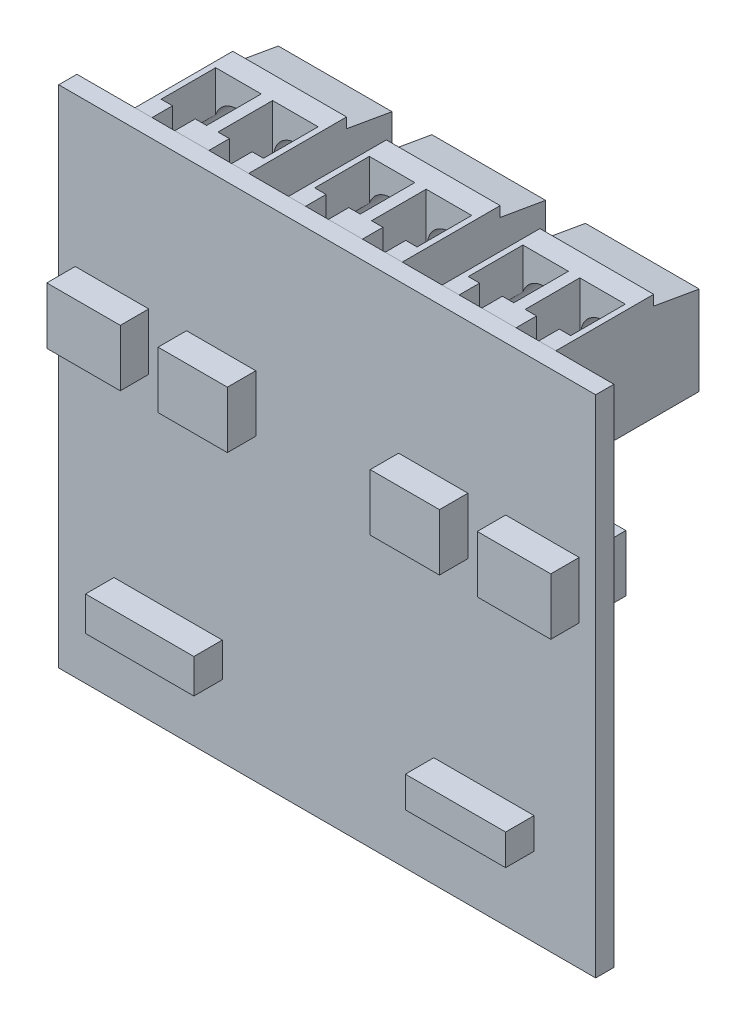
from build123d import *

# Parameters (mm, degrees)
SKETCH1_W             = 47.2
SKETCH1_H             = 44.4
BOSS_EXTRUDE1_DEPTH   = 1.6
SKETCH3_W             = 10
SKETCH3_H             = 12.6
BOSS_EXTRUDE2_DEPTH   = 9.4
BOSS_EXTRUDE2_2_DEPTH = 9.4
BOSS_EXTRUDE2_3_DEPTH = 9.4
SKETCH4_R             = 0.9
SKETCH4_R_2           = 2
CUT_EXTRUDE1_DEPTH    = 12.6
CUT_EXTRUDE2_START    = -37
CUT_EXTRUDE2_DEPTH    = 37
CUT_EXTRUDE3_DEPTH    = 8.4
SKETCH7_R             = 3.25
BOSS_EXTRUDE3_DEPTH   = 11.4
BOSS_EXTRUDE3_2_DEPTH = 11.4
SKETCH8_W             = 6.460426468
SKETCH8_H             = 4.983757561
BOSS_EXTRUDE4_DEPTH   = 2.5
SKETCH8_W_2           = 6.091259241
BOSS_EXTRUDE4_2_DEPTH = 2.5
BOSS_EXTRUDE4_3_DEPTH = 2.5
BOSS_EXTRUDE4_4_DEPTH = 2.5
BOSS_EXTRUDE5_DEPTH   = 15
CUT_EXTRUDE4_REACH    = 37.105
SKETCH10_W            = 1
SKETCH10_H            = 5.366190282
SKETCH10_W_2          = 2
CUT_EXTRUDE6_START    = -5.433939
SKETCH11_W            = 5
SKETCH11_H            = 5.781612216
CUT_EXTRUDE6_DEPTH    = 5.433939
SKETCH12_W            = 9.520452494
SKETCH12_H            = 3.010143068
BOSS_EXTRUDE6_DEPTH   = 2.5
SKETCH13_W            = 8.81009107
SKETCH13_H            = 2.717130891
BOSS_EXTRUDE7_DEPTH   = 2.5


with BuildPart() as part:
    # Sketch1 → Boss-Extrude1 (new body)
    with BuildSketch(Plane.XY):
        Rectangle(SKETCH1_W, SKETCH1_H)
    extrude(amount=-BOSS_EXTRUDE1_DEPTH)


with BuildPart() as body_2:
    # Sketch3 → Boss-Extrude2 (new body)
    with BuildSketch(Plane(origin=(0, 22.2, 0), x_dir=(1, 0, 0), z_dir=(0, 1, 0))):
        with Locations((13.5, 7.9)):
            Rectangle(SKETCH3_W, SKETCH3_H)
    extrude(amount=-BOSS_EXTRUDE2_DEPTH)


with BuildPart() as body_3:
    # Sketch3 → Boss-Extrude2 2 (new body)
    with BuildSketch(Plane(origin=(0, 22.2, 0), x_dir=(1, 0, 0), z_dir=(0, 1, 0))):
        with Locations((-13.5, 7.9)):
            Rectangle(SKETCH3_W, SKETCH3_H)
    extrude(amount=-BOSS_EXTRUDE2_2_DEPTH)


with BuildPart() as body_4:
    # Sketch3 → Boss-Extrude2 3 (new body)
    with BuildSketch(Plane(origin=(0, 22.2, 0), x_dir=(1, 0, 0), z_dir=(0, 1, 0))):
        with Locations((0, 7.9)):
            Rectangle(SKETCH3_W, SKETCH3_H)
    extrude(amount=-BOSS_EXTRUDE2_3_DEPTH)


with BuildPart() as cut_extrude1_tool:
    # Sketch4 → Cut-Extrude1 (new body)
    with BuildSketch(Plane(origin=(0, 0, -14.2), x_dir=(-1, 0, 0), z_dir=(0, 0, -1))):
        with Locations((-16.1, 14.4)):
            Circle(SKETCH4_R)
        with Locations((-10.9, 14.4)):
            Circle(SKETCH4_R)
        with Locations((-16.1, 18)):
            Circle(SKETCH4_R_2)
        with Locations((-10.9, 18)):
            Circle(SKETCH4_R_2)
        with Locations(Location((2.6, 18, 0), (0, 0, 180))):
            Circle(SKETCH4_R_2)
        with Locations(Location((2.6, 14.4, 0), (0, 0, 180))):
            Circle(SKETCH4_R)
        with Locations(Location((-2.6, 14.4, 0), (0, 0, 180))):
            Circle(SKETCH4_R)
        with Locations(Location((-2.6, 18, 0), (0, 0, 180))):
            Circle(SKETCH4_R_2)
        with Locations((16.1, 14.4)):
            Circle(SKETCH4_R)
        with Locations((16.1, 18)):
            Circle(SKETCH4_R_2)
        with Locations((10.9, 14.4)):
            Circle(SKETCH4_R)
        with Locations((10.9, 18)):
            Circle(SKETCH4_R_2)
    extrude(amount=-CUT_EXTRUDE1_DEPTH)


with BuildPart() as body_2_1:
    add(body_2.part)

    # Cut-Extrude1: cut by cut_extrude1_tool
    add(cut_extrude1_tool.part, mode=Mode.SUBTRACT)


with BuildPart() as body_3_1:
    add(body_3.part)

    # Cut-Extrude1: cut by cut_extrude1_tool
    add(cut_extrude1_tool.part, mode=Mode.SUBTRACT)


with BuildPart() as body_4_1:
    add(body_4.part)

    # Cut-Extrude1: cut by cut_extrude1_tool
    add(cut_extrude1_tool.part, mode=Mode.SUBTRACT)


with BuildPart() as cut_extrude2_tool:
    # Sketch5 → Cut-Extrude2 (new body)
    with BuildSketch(Plane.ZY.offset(18.5).offset(CUT_EXTRUDE2_START)):
        Polygon((-14.2, 20.6), (-14.2, 22.2), (-10.2, 22.2), (-10.2, 21.3), align=None)
    extrude(amount=CUT_EXTRUDE2_DEPTH)


with BuildPart() as body_2_2:
    add(body_2_1.part)

    # Cut-Extrude2: cut by cut_extrude2_tool
    add(cut_extrude2_tool.part, mode=Mode.SUBTRACT)


with BuildPart() as body_3_2:
    add(body_3_1.part)

    # Cut-Extrude2: cut by cut_extrude2_tool
    add(cut_extrude2_tool.part, mode=Mode.SUBTRACT)


with BuildPart() as body_4_2:
    add(body_4_1.part)

    # Cut-Extrude2: cut by cut_extrude2_tool
    add(cut_extrude2_tool.part, mode=Mode.SUBTRACT)


with BuildPart() as cut_extrude3_tool:
    # Sketch6 → Cut-Extrude3 (new body)
    with BuildSketch(Plane(origin=(0, 22.2, 0), x_dir=(1, 0, 0), z_dir=(0, 1, 0))):
        Polygon((-12, 1.6), (-10, 1.6), (-10, 3.4), (-9, 3.4), (-9, 8.2), (-13, 8.2), (-13, 3.4), (-12, 3.4), align=None)
        Polygon((-17, 1.6), (-15, 1.6), (-15, 3.4), (-14, 3.4), (-14, 8.2), (-18, 8.2), (-18, 3.4), (-17, 3.4), align=None)
        Polygon((-0.5, 3.4), (-1.5, 3.4), (-1.5, 1.6), (-3.5, 1.6), (-3.5, 3.4), (-4.5, 3.4), (-4.5, 8.2), (-0.5, 8.2), align=None)
        Polygon((0.5, 8.2), (4.5, 8.2), (4.5, 3.4), (3.5, 3.4), (3.5, 1.6), (1.5, 1.6), (1.5, 3.4), (0.5, 3.4), align=None)
        Polygon((15, 1.6), (17, 1.6), (17, 3.4), (18, 3.4), (18, 8.2), (14, 8.2), (14, 3.4), (15, 3.4), align=None)
        Polygon((10, 1.6), (12, 1.6), (12, 3.4), (13, 3.4), (13, 8.2), (9, 8.2), (9, 3.4), (10, 3.4), align=None)
    extrude(amount=-CUT_EXTRUDE3_DEPTH)


with BuildPart() as body_2_3:
    add(body_2_2.part)

    # Cut-Extrude3: cut by cut_extrude3_tool
    add(cut_extrude3_tool.part, mode=Mode.SUBTRACT)


with BuildPart() as body_3_3:
    add(body_3_2.part)

    # Cut-Extrude3: cut by cut_extrude3_tool
    add(cut_extrude3_tool.part, mode=Mode.SUBTRACT)


with BuildPart() as body_4_3:
    add(body_4_2.part)

    # Cut-Extrude3: cut by cut_extrude3_tool
    add(cut_extrude3_tool.part, mode=Mode.SUBTRACT)


with BuildPart() as body_5:
    # Sketch7 → Boss-Extrude3 (new body)
    with BuildSketch(Plane(origin=(0, 0, -1.6), x_dir=(-1, 0, 0), z_dir=(0, 0, -1))):
        with Locations((0, 9.3)):
            Circle(SKETCH7_R)
    extrude(amount=BOSS_EXTRUDE3_DEPTH)


with BuildPart() as body_6:
    # Sketch7 → Boss-Extrude3 2 (new body)
    with BuildSketch(Plane(origin=(0, 0, -1.6), x_dir=(-1, 0, 0), z_dir=(0, 0, -1))):
        with Locations((0, 1.3)):
            Circle(SKETCH7_R)
    extrude(amount=BOSS_EXTRUDE3_2_DEPTH)


with BuildPart() as body_7:
    # Sketch8 → Boss-Extrude4 (new body)
    with BuildSketch(Plane(origin=(0, 0, -1.6), x_dir=(-1, 0, 0), z_dir=(0, 0, -1))):
        with Locations((-18.919820371, 6.598889179)):
            Rectangle(SKETCH8_W, SKETCH8_H)
    boss_extrude4 = extrude(amount=BOSS_EXTRUDE4_DEPTH)


with BuildPart() as body_8:
    # Sketch8 → Boss-Extrude4 2 (new body)
    with BuildSketch(Plane(origin=(0, 0, -1.6), x_dir=(-1, 0, 0), z_dir=(0, 0, -1))):
        with Locations((-9.321472476, 6.598889179)):
            Rectangle(SKETCH8_W_2, SKETCH8_H)
    boss_extrude4_2 = extrude(amount=BOSS_EXTRUDE4_2_DEPTH)


with BuildPart() as body_9:
    # Sketch8 → Boss-Extrude4 3 (new body)
    with BuildSketch(Plane(origin=(0, 0, -1.6), x_dir=(-1, 0, 0), z_dir=(0, 0, -1))):
        with Locations((9.321472476, 6.598889179)):
            Rectangle(SKETCH8_W_2, SKETCH8_H)
    boss_extrude4_3 = extrude(amount=BOSS_EXTRUDE4_3_DEPTH)


with BuildPart() as body_10:
    # Sketch8 → Boss-Extrude4 4 (new body)
    with BuildSketch(Plane(origin=(0, 0, -1.6), x_dir=(-1, 0, 0), z_dir=(0, 0, -1))):
        with Locations((18.919820371, 6.598889179)):
            Rectangle(SKETCH8_W, SKETCH8_H)
    boss_extrude4_4 = extrude(amount=BOSS_EXTRUDE4_4_DEPTH)


with BuildPart() as body_11:
    # Sketch9 → Boss-Extrude5 (new, symmetric)
    with BuildSketch(Plane.ZY):
        with BuildLine():
            Line((-1.705871918, -18.684144511), (-3.536715786, -18.684144511))
            Line((-3.536715786, -18.684144511), (-3.536715786, -19.099566445))
            Line((-3.536715786, -19.099566445), (-4.433938739, -19.099566445))
            ThreePointArc((-4.433938739, -19.099566445), (-5.14104552, -19.392459664), (-5.433938739, -20.099566445))
            Line((-5.433938739, -20.099566445), (-5.433938739, -24.465756727))
            Line((-5.433938739, -24.465756727), (-4.433938739, -24.465756727))
            Line((-4.433938739, -24.465756727), (-4.433938739, -20.099566445))
            Line((-4.433938739, -20.099566445), (-3.536715786, -20.099566445))
            Line((-3.536715786, -20.099566445), (-3.536715786, -20.514988379))
            Line((-3.536715786, -20.514988379), (-1.705871918, -20.514988379))
            Line((-1.705871918, -20.514988379), (-1.705871918, -18.684144511))
        make_face()
    extrude(amount=BOSS_EXTRUDE5_DEPTH, both=True)

    # Cut-Extrude4: up to this face of the body (flat: up to its plane)
    cut_extrude4_end = Plane(body_11.part.faces().sort_by_distance((0, -20.307277412, -3.536715786))[0])
    # Sketch10 → Cut-Extrude4 (cut, up to the picked face)
    with BuildSketch(Plane(origin=(0, 0, -5.433938739), x_dir=(-1, 0, 0), z_dir=(0, 0, -1)), mode=Mode.PRIVATE) as cut_extrude4_sk1:
        with Locations((3, -21.782661586)):
            Rectangle(SKETCH10_W, SKETCH10_H)
    cut_extrude4_tool1 = split(extrude(cut_extrude4_sk1.sketch, amount=-CUT_EXTRUDE4_REACH, mode=Mode.PRIVATE), bisect_by=cut_extrude4_end, keep=Keep.BOTH, mode=Mode.PRIVATE)
    # Sketch10 → Cut-Extrude4 (cut, up to the picked face)
    with BuildSketch(Plane(origin=(0, 0, -5.433938739), x_dir=(-1, 0, 0), z_dir=(0, 0, -1)), mode=Mode.PRIVATE) as cut_extrude4_sk2:
        with Locations((5, -21.782661586)):
            Rectangle(SKETCH10_W_2, SKETCH10_H)
    cut_extrude4_tool2 = split(extrude(cut_extrude4_sk2.sketch, amount=-CUT_EXTRUDE4_REACH, mode=Mode.PRIVATE), bisect_by=cut_extrude4_end, keep=Keep.BOTH, mode=Mode.PRIVATE)
    # Sketch10 → Cut-Extrude4 (cut, up to the picked face)
    with BuildSketch(Plane(origin=(0, 0, -5.433938739), x_dir=(-1, 0, 0), z_dir=(0, 0, -1)), mode=Mode.PRIVATE) as cut_extrude4_sk3:
        with Locations((7.5, -21.782661586)):
            Rectangle(SKETCH10_W_2, SKETCH10_H)
    cut_extrude4_tool3 = split(extrude(cut_extrude4_sk3.sketch, amount=-CUT_EXTRUDE4_REACH, mode=Mode.PRIVATE), bisect_by=cut_extrude4_end, keep=Keep.BOTH, mode=Mode.PRIVATE)
    # Sketch10 → Cut-Extrude4 (cut, up to the picked face)
    with BuildSketch(Plane(origin=(0, 0, -5.433938739), x_dir=(-1, 0, 0), z_dir=(0, 0, -1)), mode=Mode.PRIVATE) as cut_extrude4_sk4:
        with Locations((10, -21.782661586)):
            Rectangle(SKETCH10_W_2, SKETCH10_H)
    cut_extrude4_tool4 = split(extrude(cut_extrude4_sk4.sketch, amount=-CUT_EXTRUDE4_REACH, mode=Mode.PRIVATE), bisect_by=cut_extrude4_end, keep=Keep.BOTH, mode=Mode.PRIVATE)
    # Sketch10 → Cut-Extrude4 (cut, up to the picked face)
    with BuildSketch(Plane(origin=(0, 0, -5.433938739), x_dir=(-1, 0, 0), z_dir=(0, 0, -1)), mode=Mode.PRIVATE) as cut_extrude4_sk5:
        with Locations((12.5, -21.782661586)):
            Rectangle(SKETCH10_W_2, SKETCH10_H)
    cut_extrude4_tool5 = split(extrude(cut_extrude4_sk5.sketch, amount=-CUT_EXTRUDE4_REACH, mode=Mode.PRIVATE), bisect_by=cut_extrude4_end, keep=Keep.BOTH, mode=Mode.PRIVATE)
    # Sketch10 → Cut-Extrude4 (cut, up to the picked face)
    with BuildSketch(Plane(origin=(0, 0, -5.433938739), x_dir=(-1, 0, 0), z_dir=(0, 0, -1)), mode=Mode.PRIVATE) as cut_extrude4_sk6:
        with Locations((14.5, -21.782661586)):
            Rectangle(SKETCH10_W, SKETCH10_H)
    cut_extrude4_tool6 = split(extrude(cut_extrude4_sk6.sketch, amount=-CUT_EXTRUDE4_REACH, mode=Mode.PRIVATE), bisect_by=cut_extrude4_end, keep=Keep.BOTH, mode=Mode.PRIVATE)
    # Sketch10 → Cut-Extrude4 (cut, up to the picked face)
    with BuildSketch(Plane(origin=(0, 0, -5.433938739), x_dir=(-1, 0, 0), z_dir=(0, 0, -1)), mode=Mode.PRIVATE) as cut_extrude4_sk7:
        with Locations((-12.5, -21.782661586)):
            Rectangle(SKETCH10_W_2, SKETCH10_H)
    cut_extrude4_tool7 = split(extrude(cut_extrude4_sk7.sketch, amount=-CUT_EXTRUDE4_REACH, mode=Mode.PRIVATE), bisect_by=cut_extrude4_end, keep=Keep.BOTH, mode=Mode.PRIVATE)
    # Sketch10 → Cut-Extrude4 (cut, up to the picked face)
    with BuildSketch(Plane(origin=(0, 0, -5.433938739), x_dir=(-1, 0, 0), z_dir=(0, 0, -1)), mode=Mode.PRIVATE) as cut_extrude4_sk8:
        with Locations((-10, -21.782661586)):
            Rectangle(SKETCH10_W_2, SKETCH10_H)
    cut_extrude4_tool8 = split(extrude(cut_extrude4_sk8.sketch, amount=-CUT_EXTRUDE4_REACH, mode=Mode.PRIVATE), bisect_by=cut_extrude4_end, keep=Keep.BOTH, mode=Mode.PRIVATE)
    # Sketch10 → Cut-Extrude4 (cut, up to the picked face)
    with BuildSketch(Plane(origin=(0, 0, -5.433938739), x_dir=(-1, 0, 0), z_dir=(0, 0, -1)), mode=Mode.PRIVATE) as cut_extrude4_sk9:
        with Locations((-7.5, -21.782661586)):
            Rectangle(SKETCH10_W_2, SKETCH10_H)
    cut_extrude4_tool9 = split(extrude(cut_extrude4_sk9.sketch, amount=-CUT_EXTRUDE4_REACH, mode=Mode.PRIVATE), bisect_by=cut_extrude4_end, keep=Keep.BOTH, mode=Mode.PRIVATE)
    # Sketch10 → Cut-Extrude4 (cut, up to the picked face)
    with BuildSketch(Plane(origin=(0, 0, -5.433938739), x_dir=(-1, 0, 0), z_dir=(0, 0, -1)), mode=Mode.PRIVATE) as cut_extrude4_sk10:
        with Locations((-5, -21.782661586)):
            Rectangle(SKETCH10_W_2, SKETCH10_H)
    cut_extrude4_tool10 = split(extrude(cut_extrude4_sk10.sketch, amount=-CUT_EXTRUDE4_REACH, mode=Mode.PRIVATE), bisect_by=cut_extrude4_end, keep=Keep.BOTH, mode=Mode.PRIVATE)
    # Sketch10 → Cut-Extrude4 (cut, up to the picked face)
    with BuildSketch(Plane(origin=(0, 0, -5.433938739), x_dir=(-1, 0, 0), z_dir=(0, 0, -1)), mode=Mode.PRIVATE) as cut_extrude4_sk11:
        with Locations((-3, -21.782661586)):
            Rectangle(SKETCH10_W, SKETCH10_H)
    cut_extrude4_tool11 = split(extrude(cut_extrude4_sk11.sketch, amount=-CUT_EXTRUDE4_REACH, mode=Mode.PRIVATE), bisect_by=cut_extrude4_end, keep=Keep.BOTH, mode=Mode.PRIVATE)
    # Sketch10 → Cut-Extrude4 (cut, up to the picked face)
    with BuildSketch(Plane(origin=(0, 0, -5.433938739), x_dir=(-1, 0, 0), z_dir=(0, 0, -1)), mode=Mode.PRIVATE) as cut_extrude4_sk12:
        with Locations((-14.5, -21.782661586)):
            Rectangle(SKETCH10_W, SKETCH10_H)
    cut_extrude4_tool12 = split(extrude(cut_extrude4_sk12.sketch, amount=-CUT_EXTRUDE4_REACH, mode=Mode.PRIVATE), bisect_by=cut_extrude4_end, keep=Keep.BOTH, mode=Mode.PRIVATE)
    add(cut_extrude4_tool1.solids().sort_by(Axis((-3, -21.782662, -5.433939), (0, 0, 1)))[0], mode=Mode.SUBTRACT)
    add(cut_extrude4_tool2.solids().sort_by(Axis((-5, -21.782662, -5.433939), (0, 0, 1)))[0], mode=Mode.SUBTRACT)
    add(cut_extrude4_tool3.solids().sort_by(Axis((-7.5, -21.782662, -5.433939), (0, 0, 1)))[0], mode=Mode.SUBTRACT)
    add(cut_extrude4_tool4.solids().sort_by(Axis((-10, -21.782662, -5.433939), (0, 0, 1)))[0], mode=Mode.SUBTRACT)
    add(cut_extrude4_tool5.solids().sort_by(Axis((-12.5, -21.782662, -5.433939), (0, 0, 1)))[0], mode=Mode.SUBTRACT)
    add(cut_extrude4_tool6.solids().sort_by(Axis((-14.5, -21.782662, -5.433939), (0, 0, 1)))[0], mode=Mode.SUBTRACT)
    add(cut_extrude4_tool7.solids().sort_by(Axis((12.5, -21.782662, -5.433939), (0, 0, 1)))[0], mode=Mode.SUBTRACT)
    add(cut_extrude4_tool8.solids().sort_by(Axis((10, -21.782662, -5.433939), (0, 0, 1)))[0], mode=Mode.SUBTRACT)
    add(cut_extrude4_tool9.solids().sort_by(Axis((7.5, -21.782662, -5.433939), (0, 0, 1)))[0], mode=Mode.SUBTRACT)
    add(cut_extrude4_tool10.solids().sort_by(Axis((5, -21.782662, -5.433939), (0, 0, 1)))[0], mode=Mode.SUBTRACT)
    add(cut_extrude4_tool11.solids().sort_by(Axis((3, -21.782662, -5.433939), (0, 0, 1)))[0], mode=Mode.SUBTRACT)
    add(cut_extrude4_tool12.solids().sort_by(Axis((14.5, -21.782662, -5.433939), (0, 0, 1)))[0], mode=Mode.SUBTRACT)

    # Sketch11 → Cut-Extrude6 (cut)
    with BuildSketch(Plane(origin=(0, 0, -5.433938739), x_dir=(-1, 0, 0), z_dir=(0, 0, -1)).offset(CUT_EXTRUDE6_START)):
        with Locations((0, -21.574950619)):
            Rectangle(SKETCH11_W, SKETCH11_H)
    extrude(amount=CUT_EXTRUDE6_DEPTH, mode=Mode.SUBTRACT)


with BuildPart() as cut_extrude6_piece_1:
    # of the separate pieces the step leaves, piece 1, a body of its own (cut_extrude6_pieces)
    add(body_11.part.solids().sort_by_distance((-15, -18.684144511, -1.705871918))[0])


with BuildPart() as cut_extrude6_piece_2:
    # of the separate pieces the step leaves, piece 2, a body of its own (cut_extrude6_pieces)
    add(body_11.part.solids().sort_by_distance((2.5, -18.684144511, -1.705871918))[0])


with BuildPart() as part_1:
    add(part.part)

    # Mirror1: Boss-Extrude4, Boss-Extrude4 2, Boss-Extrude4 3, Boss-Extrude4 4 across plane
    add(boss_extrude4.mirror(Plane.XY.offset(-0.8)))
    add(boss_extrude4_2.mirror(Plane.XY.offset(-0.8)))
    add(boss_extrude4_3.mirror(Plane.XY.offset(-0.8)))
    add(boss_extrude4_4.mirror(Plane.XY.offset(-0.8)))


with BuildPart() as body_13:
    # Sketch12 → Boss-Extrude6 (new body)
    with BuildSketch(Plane.XY):
        with Locations((-13.983555823, -14.391356883)):
            Rectangle(SKETCH12_W, SKETCH12_H)
    extrude(amount=BOSS_EXTRUDE6_DEPTH)


with BuildPart() as body_14:
    # Sketch13 → Boss-Extrude7 (new body)
    with BuildSketch(Plane.XY):
        with Locations((13.775312733, -13.904563164)):
            Rectangle(SKETCH13_W, SKETCH13_H)
    extrude(amount=BOSS_EXTRUDE7_DEPTH)


solid = Compound([body_2_3.part, body_3_3.part, body_4_3.part, body_5.part, body_6.part, body_7.part, body_8.part, body_9.part, body_10.part, cut_extrude6_piece_1.part, cut_extrude6_piece_2.part, part_1.part, body_13.part, body_14.part])
